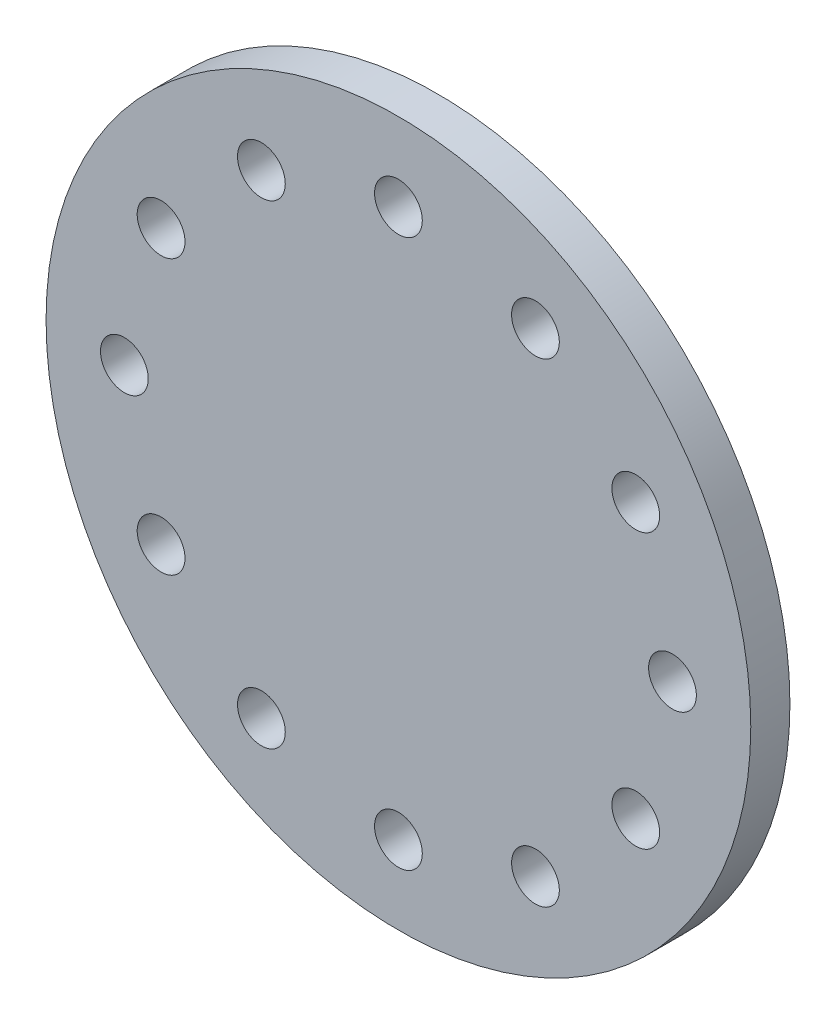
from build123d import *

# Parameters (mm, degrees)
SKETCH1_R                      = 45
BOSS_EXTRUDE1_DEPTH            = 5
F_6_1_6_1_DIAMETER_HOLE1_D     = 6.1
F_6_1_6_1_DIAMETER_HOLE1_DEPTH = 10
F_6_1_6_1_DIAMETER_HOLE1_TIP   = 1.832624888


with BuildPart() as part:
    # Sketch1 → Boss-Extrude1 (new body)
    with BuildSketch(Plane.XY):
        Circle(SKETCH1_R)
    extrude(amount=BOSS_EXTRUDE1_DEPTH)

    # Ø6.1 (6.1) Diameter Hole1
    with Locations(Plane.XY.offset(5)):
        with Locations((-35, 0), (-30.310889132, 17.5), (-17.5, 30.310889132), (0, 35), (17.5, 30.310889132), (30.310889132, 17.5), (35, 0), (30.310889132, -17.5), (17.5, -30.310889132), (0, -35), (-17.5, -30.310889132), (-30.310889132, -17.5)):
            Hole(F_6_1_6_1_DIAMETER_HOLE1_D / 2, depth=F_6_1_6_1_DIAMETER_HOLE1_DEPTH)
            with Locations((0, 0, -(F_6_1_6_1_DIAMETER_HOLE1_DEPTH + F_6_1_6_1_DIAMETER_HOLE1_TIP / 2))):  # 118° drill point
                Cone(0, F_6_1_6_1_DIAMETER_HOLE1_D / 2, F_6_1_6_1_DIAMETER_HOLE1_TIP, mode=Mode.SUBTRACT)


solid = part.part
